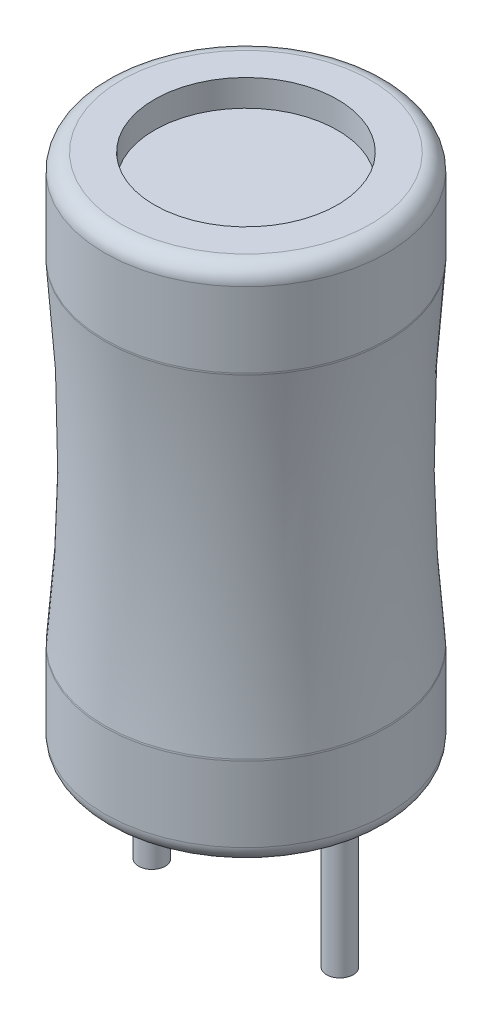
from build123d import *

# Parameters (mm, degrees)
SKETCH3_R           = 0.4
BOSS_EXTRUDE1_DEPTH = 5


with BuildPart() as part:
    # Sketch1 → Revolve1 (revolve)
    with BuildSketch(Plane(origin=(0, 0, 0), x_dir=(0, 0, -1), z_dir=(1, 0, 0))):
        with BuildLine():
            Line((-4.25, 7.3), (-4.25, 5.049389861))
            ThreePointArc((-4.25, 5.049389861), (-4.249388291, 5.024664681), (-4.247554662, 5))
            ThreePointArc((-4.247554662, 5), (-4, 0), (-4.247554662, -5))
            ThreePointArc((-4.247554662, -5), (-4.249388291, -5.024664681), (-4.25, -5.049389861))
            Line((-4.25, -5.049389861), (-4.25, -7.3))
            ThreePointArc((-4.25, -7.3), (-4.103553391, -7.653553391), (-3.75, -7.8))
            Line((-3.75, -7.8), (-2.75, -7.8))
            Line((-2.75, -7.8), (-2.75, -7))
            Line((-2.75, -7), (0, -7))
            Line((0, -7), (0, 7))
            Line((0, 7), (-2.75, 7))
            Line((-2.75, 7), (-2.75, 7.8))
            Line((-2.75, 7.8), (-3.75, 7.8))
            ThreePointArc((-3.75, 7.8), (-4.103553391, 7.653553391), (-4.25, 7.3))
        make_face()
    revolve(axis=Axis((0, 12.565257793, 0), (0, -1, 0)))

    # Sketch3 → Boss-Extrude1 (add)
    with BuildSketch(Plane.XZ.offset(7)):
        with Locations(Location((-2.825, 0, 0), (0, 0, 75.178560111))):
            Circle(SKETCH3_R)
        with Locations(Location((2.825, 0, 0), (0, 0, 90))):
            Circle(SKETCH3_R)
    extrude(amount=BOSS_EXTRUDE1_DEPTH)


solid = part.part
